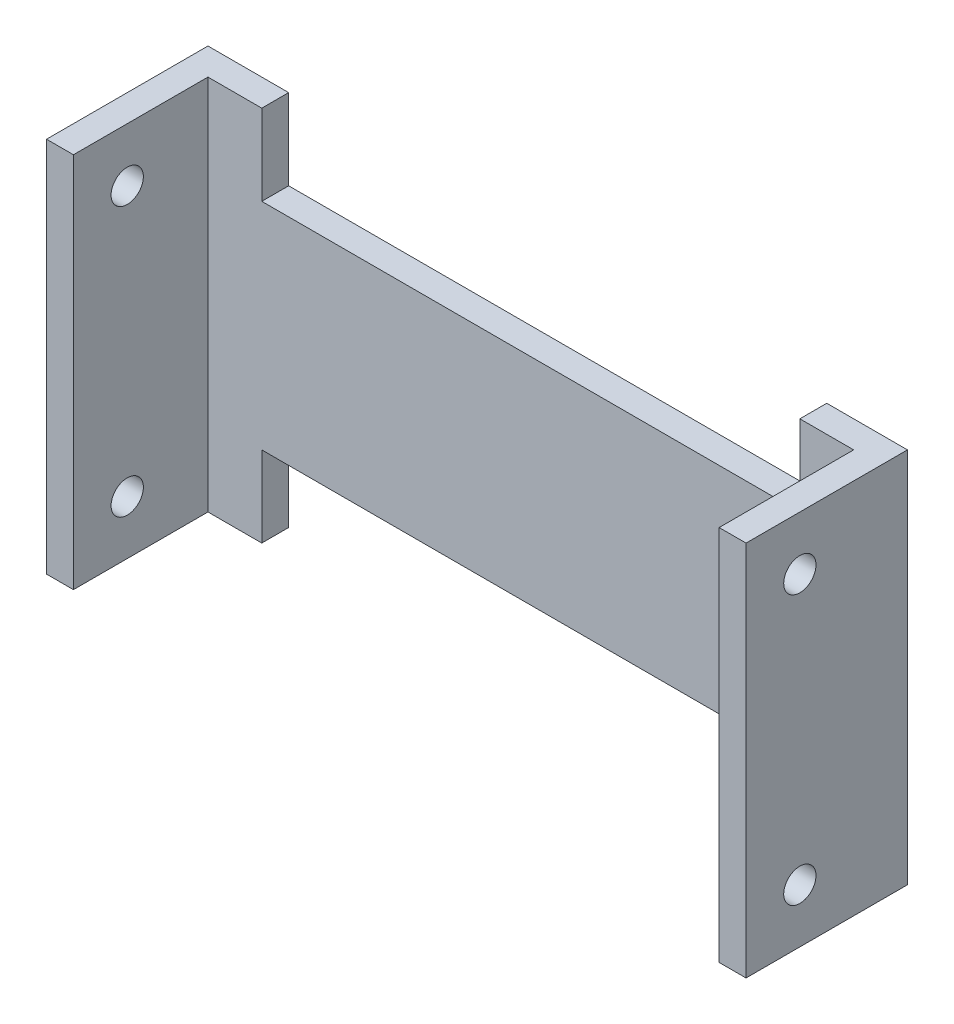
from build123d import *

# Parameters (mm, degrees)
BOSS_EXTRUDE1_DEPTH = 35
SKETCH2_W           = 100
SKETCH2_H           = 15
CUT_EXTRUDE1_DEPTH  = 5
SKETCH3_R           = 3
CUT_EXTRUDE2_DEPTH  = 138.931142241
SKETCH4_R           = 8
CUT_EXTRUDE3_DEPTH  = 3


with BuildPart() as part:
    # Sketch1 → Boss-Extrude1 (new, symmetric)
    with BuildSketch(Plane(origin=(0, 0, 0), x_dir=(1, 0, 0), z_dir=(0, 1, 0))):
        Polygon((0, 0), (65, 0), (65, -30), (60, -30), (60, -5), (0, -5), (-60, -5), (-60, -30), (-65, -30), (-65, 0), align=None)
    extrude(amount=BOSS_EXTRUDE1_DEPTH, both=True)

    # Sketch2 → Cut-Extrude1 (cut)
    with BuildSketch(Plane(origin=(0, 0, 0), x_dir=(-1, 0, 0), z_dir=(0, 0, -1))):
        with Locations((0, -27.5)):
            Rectangle(SKETCH2_W, SKETCH2_H)
        with Locations((0, 27.5)):
            Rectangle(SKETCH2_W, SKETCH2_H)
    extrude(amount=-CUT_EXTRUDE1_DEPTH, mode=Mode.SUBTRACT)

    # Sketch3 → Cut-Extrude2 (cut, through all)
    with BuildSketch(Plane.ZY.offset(65)):
        with Locations((20, 25)):
            Circle(SKETCH3_R)
        with Locations(Location((20, -25, 0), (0, 0, 180))):
            Circle(SKETCH3_R)
    extrude(amount=-CUT_EXTRUDE2_DEPTH, mode=Mode.SUBTRACT)

    # Sketch4 → Cut-Extrude3 (cut)
    with BuildSketch(Plane(origin=(0, 0, 0), x_dir=(-1, 0, 0), z_dir=(0, 0, -1))):
        Circle(SKETCH4_R)
    extrude(amount=-CUT_EXTRUDE3_DEPTH, mode=Mode.SUBTRACT)


solid = part.part
